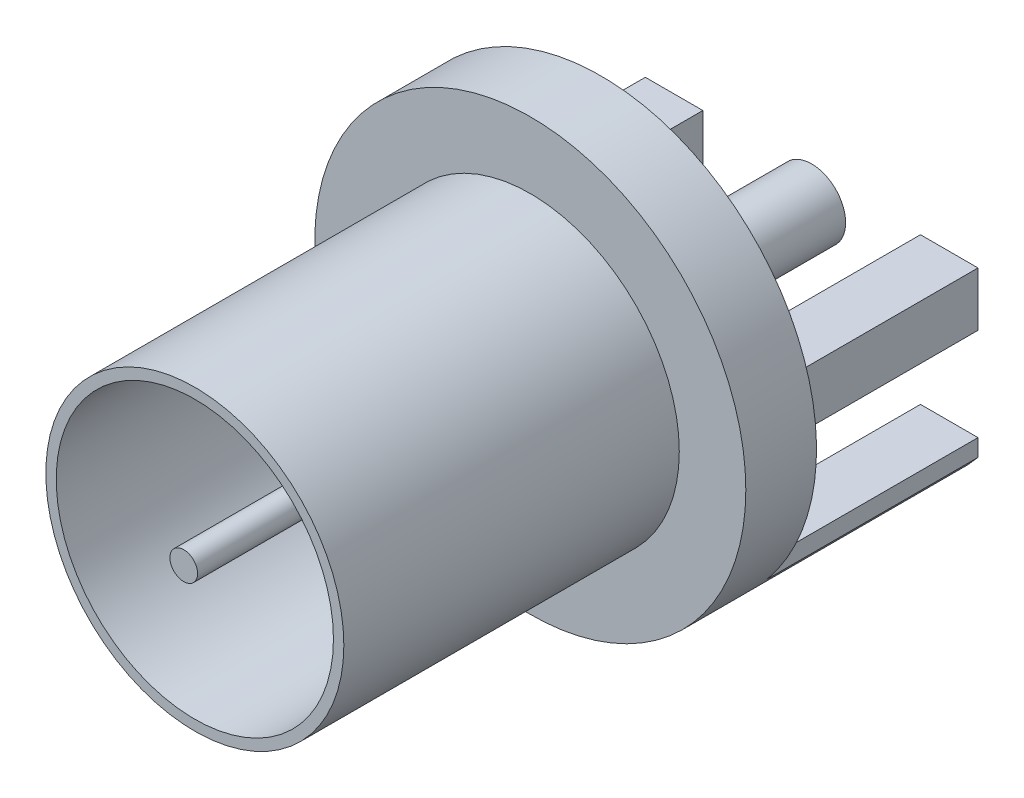
from build123d import *

# Parameters (mm, degrees)
SKETCH1_R           = 3.9497
BOSS_EXTRUDE1_DEPTH = 1.2954
SKETCH2_R           = 2.7305
SKETCH2_R_2         = 2.54
BOSS_EXTRUDE2_DEPTH = 6.1468
BOSS_EXTRUDE3_START = 3.8608
SKETCH3_W           = 1.0541
SKETCH3_H           = 0.968198064
SKETCH3_H_2         = 0.9906
BOSS_EXTRUDE3_DEPTH = 3.8608
SKETCH4_R           = 0.6223
BOSS_EXTRUDE4_DEPTH = 3.8608
SKETCH5_R           = 0.254
BOSS_EXTRUDE5_DEPTH = 6.35


with BuildPart() as part:
    # Sketch1 → Boss-Extrude1 (new body)
    with BuildSketch(Plane.XY):
        Circle(SKETCH1_R)
    extrude(amount=BOSS_EXTRUDE1_DEPTH)

    # Sketch2 → Boss-Extrude2 (add)
    with BuildSketch(Plane.XY.offset(1.2954)):
        Circle(SKETCH2_R)
        Circle(SKETCH2_R_2, mode=Mode.SUBTRACT)
    extrude(amount=BOSS_EXTRUDE2_DEPTH)

    # Sketch3 → Boss-Extrude3 (add)
    with BuildSketch(Plane(origin=(0, 0, 0), x_dir=(-1, 0, 0), z_dir=(0, 0, -1)).offset(BOSS_EXTRUDE3_START)):
        with Locations((2.52095, -0.011200968)):
            Rectangle(SKETCH3_W, SKETCH3_H)
        with Locations((-2.52095, 0)):
            Rectangle(SKETCH3_W, SKETCH3_H_2)
        with BuildLine():
            Line((-1.9939, -3.409471056), (-1.9939, -2.1971))
            Line((-1.9939, -2.1971), (-3.048, -2.1971))
            Line((-3.048, -2.1971), (-3.048, -2.511936721))
            ThreePointArc((-3.048, -2.511936721), (-2.560582136, -3.007249444), (-1.9939, -3.409471056))
        make_face()
        with BuildLine():
            Line((1.9939, -2.1971), (3.048, -2.1971))
            Line((3.048, -2.1971), (3.048, -2.511936721))
            ThreePointArc((3.048, -2.511936721), (2.560582136, -3.007249444), (1.9939, -3.409471056))
            Line((1.9939, -3.409471056), (1.9939, -2.1971))
        make_face()
    extrude(amount=-BOSS_EXTRUDE3_DEPTH)

    # Sketch4 → Boss-Extrude4 (add)
    with BuildSketch(Plane(origin=(0, 0, 0), x_dir=(-1, 0, 0), z_dir=(0, 0, -1))):
        with Locations(Location((0, 0, 0), (0, 0, 180))):
            Circle(SKETCH4_R)
    extrude(amount=BOSS_EXTRUDE4_DEPTH)

    # Sketch5 → Boss-Extrude5 (add)
    with BuildSketch(Plane.XY.offset(1.2954)):
        Circle(SKETCH5_R)
    extrude(amount=BOSS_EXTRUDE5_DEPTH)


solid = part.part
